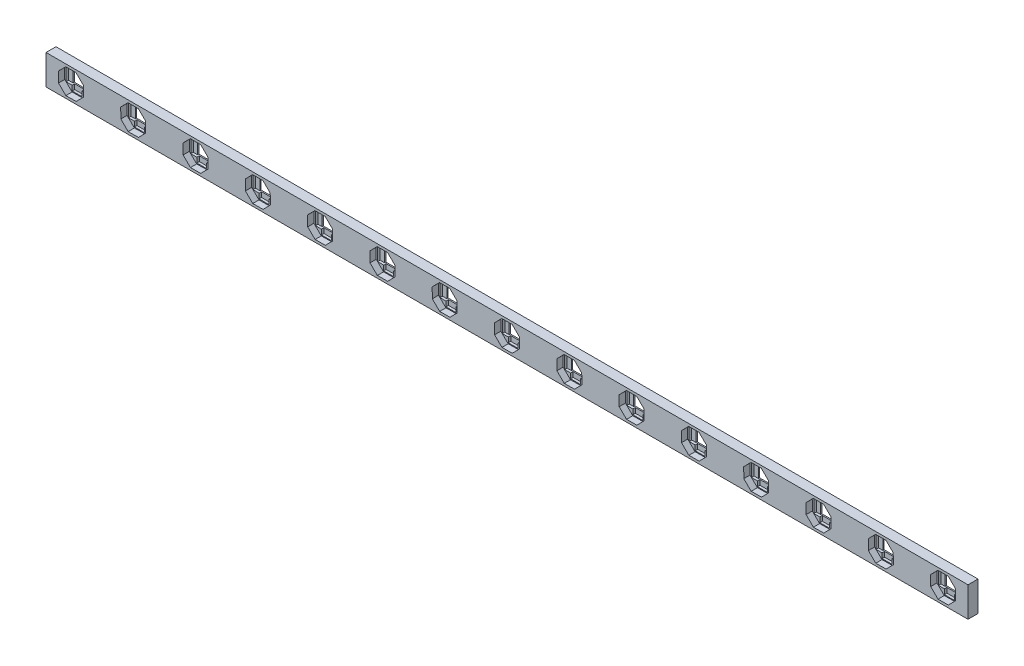
from build123d import *

# Parameters (mm, degrees)
SKETCH1_W           = 370
SKETCH1_H           = 12
BOSS_EXTRUDE1_DEPTH = 4
CUT_EXTRUDE1_DEPTH  = 2.5
SKETCH4_W           = 5.3
SKETCH4_H           = 5.3
CUT_EXTRUDE2_DEPTH  = 380.776937801
SKETCH6_W           = 4
SKETCH6_H           = 2
CUT_EXTRUDE3_DEPTH  = 1
SKETCH7_W           = 4
SKETCH7_H           = 2
CUT_EXTRUDE4_DEPTH  = 1
SKETCH10_W          = 1.75
SKETCH10_H          = 5.333464967
SKETCH10_H_2        = 5.3
CUT_EXTRUDE7_DEPTH  = 1
LPATTERN1_COUNT     = 15
LPATTERN1_PITCH     = 25


with BuildPart() as part:
    # Sketch1 → Boss-Extrude1 (new body)
    with BuildSketch(Plane.XY):
        with Locations((-194.69924812, 1.263157895)):
            Rectangle(SKETCH1_W, SKETCH1_H)
    extrude(amount=BOSS_EXTRUDE1_DEPTH)

    # Sketch3 → Cut-Extrude1 (cut)
    with BuildSketch(Plane.XY.offset(4)):
        Polygon((-17.589220634, -3.720526073), (-14.683236648, -0.76882409), (-14.715564153, 3.373185381), (-17.667266136, 6.279169368), (-21.809275607, 6.246841862), (-24.715259593, 3.295139879), (-24.682932088, -0.846869592), (-21.731230105, -3.752853578), align=None)
    cut_extrude1 = extrude(amount=-CUT_EXTRUDE1_DEPTH, mode=Mode.SUBTRACT)

    # Sketch4 → Cut-Extrude2 (cut, through all)
    with BuildSketch(Plane.XY.offset(1.5)):
        with Locations((-19.69924812, 1.263157895)):
            Rectangle(SKETCH4_W, SKETCH4_H)
    cut_extrude2 = extrude(amount=-CUT_EXTRUDE2_DEPTH, mode=Mode.SUBTRACT)

    # Sketch6 → Cut-Extrude3 (cut)
    with BuildSketch(Plane.XY.offset(1.5)):
        with Locations((-19.69924812, -2.386842105)):
            Rectangle(SKETCH6_W, SKETCH6_H)
    cut_extrude3 = extrude(amount=-CUT_EXTRUDE3_DEPTH, mode=Mode.SUBTRACT)

    # Sketch7 → Cut-Extrude4 (cut)
    with BuildSketch(Plane.XY.offset(1.5)):
        with Locations((-19.69924812, 4.913157895)):
            Rectangle(SKETCH7_W, SKETCH7_H)
    cut_extrude4 = extrude(amount=-CUT_EXTRUDE4_DEPTH, mode=Mode.SUBTRACT)

    # Sketch10 → Cut-Extrude7 (cut)
    with BuildSketch(Plane.XY.offset(1.5)):
        with Locations((-16.17424812, 1.246425412)):
            Rectangle(SKETCH10_W, SKETCH10_H)
        with Locations((-23.22424812, 1.263157895)):
            Rectangle(SKETCH10_W, SKETCH10_H_2)
    cut_extrude7 = extrude(amount=-CUT_EXTRUDE7_DEPTH, mode=Mode.SUBTRACT)

    # LPattern1: Cut-Extrude1, Cut-Extrude2, Cut-Extrude3, Cut-Extrude4, Cut-Extrude7 ×15
    with Locations(*[(-i * LPATTERN1_PITCH, 0, 0) for i in range(1, LPATTERN1_COUNT)]):
        add(cut_extrude1, mode=Mode.SUBTRACT)
        add(cut_extrude2, mode=Mode.SUBTRACT)
        add(cut_extrude3, mode=Mode.SUBTRACT)
        add(cut_extrude4, mode=Mode.SUBTRACT)
        add(cut_extrude7, mode=Mode.SUBTRACT)


solid = part.part
